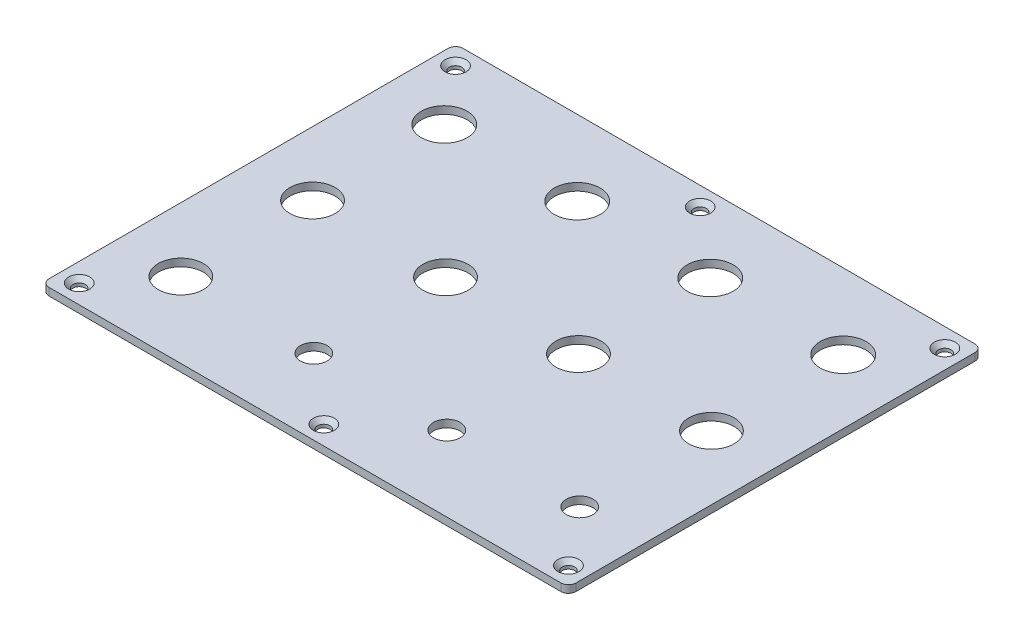
from build123d import *

# Parameters (mm, degrees)
BOTTOM_PLATE_W                       = 140
BOTTOM_PLATE_H                       = 110
BOTTOM_PLATE_EXT_DEPTH               = 2
MIDDLE_ROW_R                         = 6
MIDDLE_ROW_CUT_DEPTH                 = 179.056170912
TOP_ROW_R                            = 6.1
TOP_ROW_CUT_DEPTH                    = 179.056170912
BOTTOM_ROW_R                         = 3.55
BOTTOM_ROW_R_2                       = 6
BOTTOM_ROW_CUT_DEPTH                 = 179.056170912
PLATE_SCREWS_R                       = 1.65
PLATE_SCREWS_CUT_DEPTH               = 179.056170912
PLATE_SCREW_HEAD_R                   = 2.8
PLATE_SCREW_HEAD_CUT_DEPTH           = 2
PLATE_SCREW_HEAD_CUT_DRAFT           = -45
PLATE_SCREW_HEAD_CUT_PROFILE_2_DEPTH = 2
PLATE_SCREW_HEAD_CUT_PROFILE_2_DRAFT = -45
PLATE_SCREW_HEAD_CUT_PROFILE_3_DEPTH = 2
PLATE_SCREW_HEAD_CUT_PROFILE_3_DRAFT = -45
PLATE_SCREW_HEAD_CUT_PROFILE_4_DEPTH = 2
PLATE_SCREW_HEAD_CUT_PROFILE_4_DRAFT = -45
PLATE_SCREW_HEAD_CUT_PROFILE_5_DEPTH = 2
PLATE_SCREW_HEAD_CUT_PROFILE_5_DRAFT = -45
PLATE_SCREW_HEAD_CUT_PROFILE_6_DEPTH = 2
PLATE_SCREW_HEAD_CUT_PROFILE_6_DRAFT = -45
FILLET1_R                            = 2
FILLET2_R                            = 2
FILLET3_R                            = 2
FILLET4_R                            = 2


with BuildPart() as part:
    # Bottom Plate → Bottom Plate EXT (new body)
    with BuildSketch(Plane(origin=(0, 0, 0), x_dir=(1, 0, 0), z_dir=(0, 1, 0))):
        with Locations((-70, 55)):
            Rectangle(BOTTOM_PLATE_W, BOTTOM_PLATE_H)
    extrude(amount=BOTTOM_PLATE_EXT_DEPTH)

    # Middle Row → Middle Row Cut (cut, through all)
    with BuildSketch(Plane(origin=(0, 2, 0), x_dir=(1, 0, 0), z_dir=(0, 1, 0))):
        with Locations(Location((-123, 55, 0), (0, 0, 270))):
            Circle(MIDDLE_ROW_R)
        with Locations(Location((-87.666666667, 55, 0), (0, 0, 270))):
            Circle(MIDDLE_ROW_R)
        with Locations(Location((-52.333333333, 55, 0), (0, 0, 270))):
            Circle(MIDDLE_ROW_R)
        with Locations(Location((-17, 55, 0), (0, 0, 270))):
            Circle(MIDDLE_ROW_R)
    extrude(amount=-MIDDLE_ROW_CUT_DEPTH, mode=Mode.SUBTRACT)

    # Top Row → Top Row Cut (cut, through all)
    with BuildSketch(Plane(origin=(0, 2, 0), x_dir=(1, 0, 0), z_dir=(0, 1, 0))):
        with Locations(Location((-123, 90, 0), (0, 0, 270))):
            Circle(TOP_ROW_R)
        with Locations(Location((-87.666666667, 90, 0), (0, 0, 270))):
            Circle(TOP_ROW_R)
        with Locations(Location((-52.333333333, 90, 0), (0, 0, 270))):
            Circle(TOP_ROW_R)
        with Locations(Location((-17, 90, 0), (0, 0, 270))):
            Circle(TOP_ROW_R)
    extrude(amount=-TOP_ROW_CUT_DEPTH, mode=Mode.SUBTRACT)

    # Bottom Row → Bottom Row Cut (cut, through all)
    with BuildSketch(Plane(origin=(0, 2, 0), x_dir=(1, 0, 0), z_dir=(0, 1, 0))):
        with Locations(Location((-87.666666667, 20, 0), (0, 0, 270))):
            Circle(BOTTOM_ROW_R)
        with Locations(Location((-52.333333333, 20, 0), (0, 0, 270))):
            Circle(BOTTOM_ROW_R)
        with Locations(Location((-17, 20, 0), (0, 0, 270))):
            Circle(BOTTOM_ROW_R)
        with Locations(Location((-123, 20, 0), (0, 0, 270))):
            Circle(BOTTOM_ROW_R_2)
    extrude(amount=-BOTTOM_ROW_CUT_DEPTH, mode=Mode.SUBTRACT)

    # Plate Screws → Plate Screws Cut (cut, through all)
    with BuildSketch(Plane(origin=(0, 2, 0), x_dir=(1, 0, 0), z_dir=(0, 1, 0))):
        with Locations(Location((-135, 105, 0), (0, 0, 270))):
            Circle(PLATE_SCREWS_R)
        with Locations(Location((-5, 105, 0), (0, 0, 270))):
            Circle(PLATE_SCREWS_R)
        with Locations(Location((-5, 5, 0), (0, 0, 270))):
            Circle(PLATE_SCREWS_R)
        with Locations(Location((-135, 5, 0), (0, 0, 270))):
            Circle(PLATE_SCREWS_R)
        with Locations(Location((-70, 105, 0), (0, 0, 270))):
            Circle(PLATE_SCREWS_R)
        with Locations(Location((-70, 5, 0), (0, 0, 90))):
            Circle(PLATE_SCREWS_R)
    extrude(amount=-PLATE_SCREWS_CUT_DEPTH, mode=Mode.SUBTRACT)


with BuildPart() as plate_screw_head_cut_tool:
    # Plate Screw Head → Plate Screw Head Cut (with draft: the straight prism first)
    with BuildSketch(Plane(origin=(0, 2, 0), x_dir=(1, 0, 0), z_dir=(0, 1, 0))):
        with Locations((-135, 105)):
            Circle(PLATE_SCREW_HEAD_R)
    extrude(amount=-PLATE_SCREW_HEAD_CUT_DEPTH)
    # Plate Screw Head Cut: the draft: its side faces are tilted about the plane it starts from
    plate_screw_head_cut_sides = [plate_screw_head_cut_tool.faces().sort_by_distance(p)[0] for p in [
        (-137.8, 1, -105),
    ]]
    draft(plate_screw_head_cut_sides, Plane(origin=(0, 2, 0), x_dir=(1, 0, 0), z_dir=(0, 1, 0)), PLATE_SCREW_HEAD_CUT_DRAFT)


with BuildPart() as part_1:
    add(part.part)

    # Plate Screw Head Cut: cut by plate_screw_head_cut_tool
    add(plate_screw_head_cut_tool.part, mode=Mode.SUBTRACT)


with BuildPart() as plate_screw_head_cut_profile_2_tool:
    # Plate Screw Head → Plate Screw Head Cut profile 2 (with draft: the straight prism first)
    with BuildSketch(Plane(origin=(0, 2, 0), x_dir=(1, 0, 0), z_dir=(0, 1, 0))):
        with Locations((-5, 105)):
            Circle(PLATE_SCREW_HEAD_R)
    extrude(amount=-PLATE_SCREW_HEAD_CUT_PROFILE_2_DEPTH)
    # Plate Screw Head Cut profile 2: the draft: its side faces are tilted about the plane it starts from
    plate_screw_head_cut_profile_2_sides = [plate_screw_head_cut_profile_2_tool.faces().sort_by_distance(p)[0] for p in [
        (-7.8, 1, -105),
    ]]
    draft(plate_screw_head_cut_profile_2_sides, Plane(origin=(0, 2, 0), x_dir=(1, 0, 0), z_dir=(0, 1, 0)), PLATE_SCREW_HEAD_CUT_PROFILE_2_DRAFT)


with BuildPart() as part_2:
    add(part_1.part)

    # Plate Screw Head Cut profile 2: cut by plate_screw_head_cut_profile_2_tool
    add(plate_screw_head_cut_profile_2_tool.part, mode=Mode.SUBTRACT)


with BuildPart() as plate_screw_head_cut_profile_3_tool:
    # Plate Screw Head → Plate Screw Head Cut profile 3 (with draft: the straight prism first)
    with BuildSketch(Plane(origin=(0, 2, 0), x_dir=(1, 0, 0), z_dir=(0, 1, 0))):
        with Locations((-5, 5)):
            Circle(PLATE_SCREW_HEAD_R)
    extrude(amount=-PLATE_SCREW_HEAD_CUT_PROFILE_3_DEPTH)
    # Plate Screw Head Cut profile 3: the draft: its side faces are tilted about the plane it starts from
    plate_screw_head_cut_profile_3_sides = [plate_screw_head_cut_profile_3_tool.faces().sort_by_distance(p)[0] for p in [
        (-7.8, 1, -5),
    ]]
    draft(plate_screw_head_cut_profile_3_sides, Plane(origin=(0, 2, 0), x_dir=(1, 0, 0), z_dir=(0, 1, 0)), PLATE_SCREW_HEAD_CUT_PROFILE_3_DRAFT)


with BuildPart() as part_3:
    add(part_2.part)

    # Plate Screw Head Cut profile 3: cut by plate_screw_head_cut_profile_3_tool
    add(plate_screw_head_cut_profile_3_tool.part, mode=Mode.SUBTRACT)


with BuildPart() as plate_screw_head_cut_profile_4_tool:
    # Plate Screw Head → Plate Screw Head Cut profile 4 (with draft: the straight prism first)
    with BuildSketch(Plane(origin=(0, 2, 0), x_dir=(1, 0, 0), z_dir=(0, 1, 0))):
        with Locations((-135, 5)):
            Circle(PLATE_SCREW_HEAD_R)
    extrude(amount=-PLATE_SCREW_HEAD_CUT_PROFILE_4_DEPTH)
    # Plate Screw Head Cut profile 4: the draft: its side faces are tilted about the plane it starts from
    plate_screw_head_cut_profile_4_sides = [plate_screw_head_cut_profile_4_tool.faces().sort_by_distance(p)[0] for p in [
        (-137.8, 1, -5),
    ]]
    draft(plate_screw_head_cut_profile_4_sides, Plane(origin=(0, 2, 0), x_dir=(1, 0, 0), z_dir=(0, 1, 0)), PLATE_SCREW_HEAD_CUT_PROFILE_4_DRAFT)


with BuildPart() as part_4:
    add(part_3.part)

    # Plate Screw Head Cut profile 4: cut by plate_screw_head_cut_profile_4_tool
    add(plate_screw_head_cut_profile_4_tool.part, mode=Mode.SUBTRACT)


with BuildPart() as plate_screw_head_cut_profile_5_tool:
    # Plate Screw Head → Plate Screw Head Cut profile 5 (with draft: the straight prism first)
    with BuildSketch(Plane(origin=(0, 2, 0), x_dir=(1, 0, 0), z_dir=(0, 1, 0))):
        with Locations((-70, 105)):
            Circle(PLATE_SCREW_HEAD_R)
    extrude(amount=-PLATE_SCREW_HEAD_CUT_PROFILE_5_DEPTH)
    # Plate Screw Head Cut profile 5: the draft: its side faces are tilted about the plane it starts from
    plate_screw_head_cut_profile_5_sides = [plate_screw_head_cut_profile_5_tool.faces().sort_by_distance(p)[0] for p in [
        (-72.8, 1, -105),
    ]]
    draft(plate_screw_head_cut_profile_5_sides, Plane(origin=(0, 2, 0), x_dir=(1, 0, 0), z_dir=(0, 1, 0)), PLATE_SCREW_HEAD_CUT_PROFILE_5_DRAFT)


with BuildPart() as part_5:
    add(part_4.part)

    # Plate Screw Head Cut profile 5: cut by plate_screw_head_cut_profile_5_tool
    add(plate_screw_head_cut_profile_5_tool.part, mode=Mode.SUBTRACT)


with BuildPart() as plate_screw_head_cut_profile_6_tool:
    # Plate Screw Head → Plate Screw Head Cut profile 6 (with draft: the straight prism first)
    with BuildSketch(Plane(origin=(0, 2, 0), x_dir=(1, 0, 0), z_dir=(0, 1, 0))):
        with Locations((-70, 5)):
            Circle(PLATE_SCREW_HEAD_R)
    extrude(amount=-PLATE_SCREW_HEAD_CUT_PROFILE_6_DEPTH)
    # Plate Screw Head Cut profile 6: the draft: its side faces are tilted about the plane it starts from
    plate_screw_head_cut_profile_6_sides = [plate_screw_head_cut_profile_6_tool.faces().sort_by_distance(p)[0] for p in [
        (-72.8, 1, -5),
    ]]
    draft(plate_screw_head_cut_profile_6_sides, Plane(origin=(0, 2, 0), x_dir=(1, 0, 0), z_dir=(0, 1, 0)), PLATE_SCREW_HEAD_CUT_PROFILE_6_DRAFT)


with BuildPart() as part_6:
    add(part_5.part)

    # Plate Screw Head Cut profile 6: cut by plate_screw_head_cut_profile_6_tool
    add(plate_screw_head_cut_profile_6_tool.part, mode=Mode.SUBTRACT)

    # Fillet1
    fillet1_edges = [part_6.edges().sort_by_distance(p)[0] for p in [
        (-140, 1, -110),
    ]]
    fillet(fillet1_edges, radius=FILLET1_R)

    # Fillet2
    fillet2_edges = [part_6.edges().sort_by_distance(p)[0] for p in [
        (0, 1, -110),
    ]]
    fillet(fillet2_edges, radius=FILLET2_R)

    # Fillet3
    fillet3_edges = [part_6.edges().sort_by_distance(p)[0] for p in [
        (0, 1, 0),
    ]]
    fillet(fillet3_edges, radius=FILLET3_R)

    # Fillet4
    fillet4_edges = [part_6.edges().sort_by_distance(p)[0] for p in [
        (-140, 1, 0),
    ]]
    fillet(fillet4_edges, radius=FILLET4_R)


solid = part_6.part
